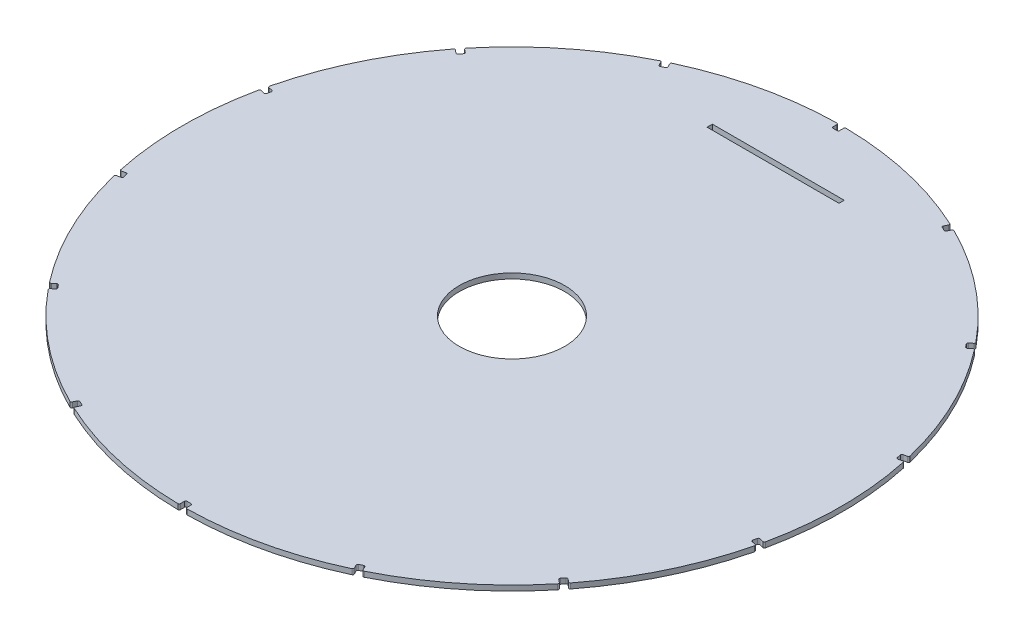
from build123d import *

# Parameters (mm, degrees)
SKETCH1_R                = 250
BOSS_EXTRUDE1_DEPTH      = 4
CUT_EXTRUDE5_DEPTH       = 4
FILLET1_R                = 1
CIRPATTERN1_COUNT        = 14
FILLET1_OF_CIRPATTERN1_R = 1
SKETCH12_R               = 40
CUT_EXTRUDE6_DEPTH       = 10
SKETCH16_W               = 100
SKETCH16_H               = 4
CUT_EXTRUDE10_DEPTH      = 100


with BuildPart() as part:
    # Sketch1 → Boss-Extrude1 (new body)
    with BuildSketch(Plane(origin=(0, 0, 0), x_dir=(1, 0, 0), z_dir=(0, 1, 0))):
        with Locations(Location((0, 0, 0), (0, 0, 270))):
            Circle(SKETCH1_R)
    extrude(amount=BOSS_EXTRUDE1_DEPTH)

    # Sketch11 → Cut-Extrude5 (cut)
    with BuildSketch(Plane(origin=(0, 4, 0), x_dir=(1, 0, 0), z_dir=(0, 1, 0))):
        with BuildLine():
            Line((1.5, 245), (-1.5, 245))
            ThreePointArc((-1.5, 245), (-2.207106781, 245.292893219), (-2.5, 246))
            Line((-2.5, 246), (-2.5, 255))
            Line((-2.5, 255), (2.5, 255))
            Line((2.5, 255), (2.5, 246))
            ThreePointArc((2.5, 246), (2.207106781, 245.292893219), (1.5, 245))
        make_face()
    cut_extrude5 = extrude(amount=-CUT_EXTRUDE5_DEPTH, mode=Mode.SUBTRACT)

    # Fillet1
    fillet1_edges = [part.edges().sort_by_distance(p)[0] for p in [
        (-2.5, 2, -249.987499687),
        (2.5, 2, -249.987499687),
    ]]
    fillet(fillet1_edges, radius=FILLET1_R)

    # CirPattern1: Cut-Extrude5 ×14 about axis
    cirpattern1_axis = Axis((0, 0, 0), (0, 1, 0))
    for i in range(1, CIRPATTERN1_COUNT):
        add(cut_extrude5.rotate(cirpattern1_axis, i * 360 / CIRPATTERN1_COUNT), mode=Mode.SUBTRACT)

    # Fillet1 of CirPattern1
    fillet1_of_cirpattern1_edges = [part.edges().sort_by_distance(p)[0] for p in [
        (-110.717933267, 2, -224.146245235),
        (-106.213088927, 2, -226.315663931),
        (-197.006821984, 2, -153.910077941),
        (-193.889372974, 2, -157.819235353),
        (-244.276093477, 2, -53.190132127),
        (-243.163488807, 2, -58.064771688),
        (-243.163488807, 2, 58.064771688),
        (-244.276093477, 2, 53.190132127),
        (-193.889372974, 2, 157.819235353),
        (-197.006821984, 2, 153.910077941),
        (-106.213088927, 2, 226.315663931),
        (-110.717933267, 2, 224.146245235),
        (2.5, 2, 249.987499687),
        (-2.5, 2, 249.987499687),
        (110.717933267, 2, 224.146245235),
        (106.213088927, 2, 226.315663931),
        (197.006821984, 2, 153.910077941),
        (193.889372974, 2, 157.819235353),
        (244.276093477, 2, 53.190132127),
        (243.163488807, 2, 58.064771688),
        (243.163488807, 2, -58.064771688),
        (244.276093477, 2, -53.190132127),
        (193.889372974, 2, -157.819235353),
        (197.006821984, 2, -153.910077941),
        (106.213088927, 2, -226.315663931),
        (110.717933267, 2, -224.146245235),
    ]]
    fillet(fillet1_of_cirpattern1_edges, radius=FILLET1_OF_CIRPATTERN1_R)

    # Sketch12 → Cut-Extrude6 (cut)
    with BuildSketch(Plane(origin=(0, 4, 0), x_dir=(1, 0, 0), z_dir=(0, 1, 0))):
        with Locations(Location((0, 0, 0), (0, 0, 270))):
            Circle(SKETCH12_R)
    extrude(amount=-CUT_EXTRUDE6_DEPTH, mode=Mode.SUBTRACT)

    # Sketch16 → Cut-Extrude10 (cut)
    with BuildSketch(Plane(origin=(0, 4, 0), x_dir=(1, 0, 0), z_dir=(0, 1, 0))):
        with Locations((0, 200)):
            Rectangle(SKETCH16_W, SKETCH16_H)
    extrude(amount=-CUT_EXTRUDE10_DEPTH, mode=Mode.SUBTRACT)


solid = part.part
